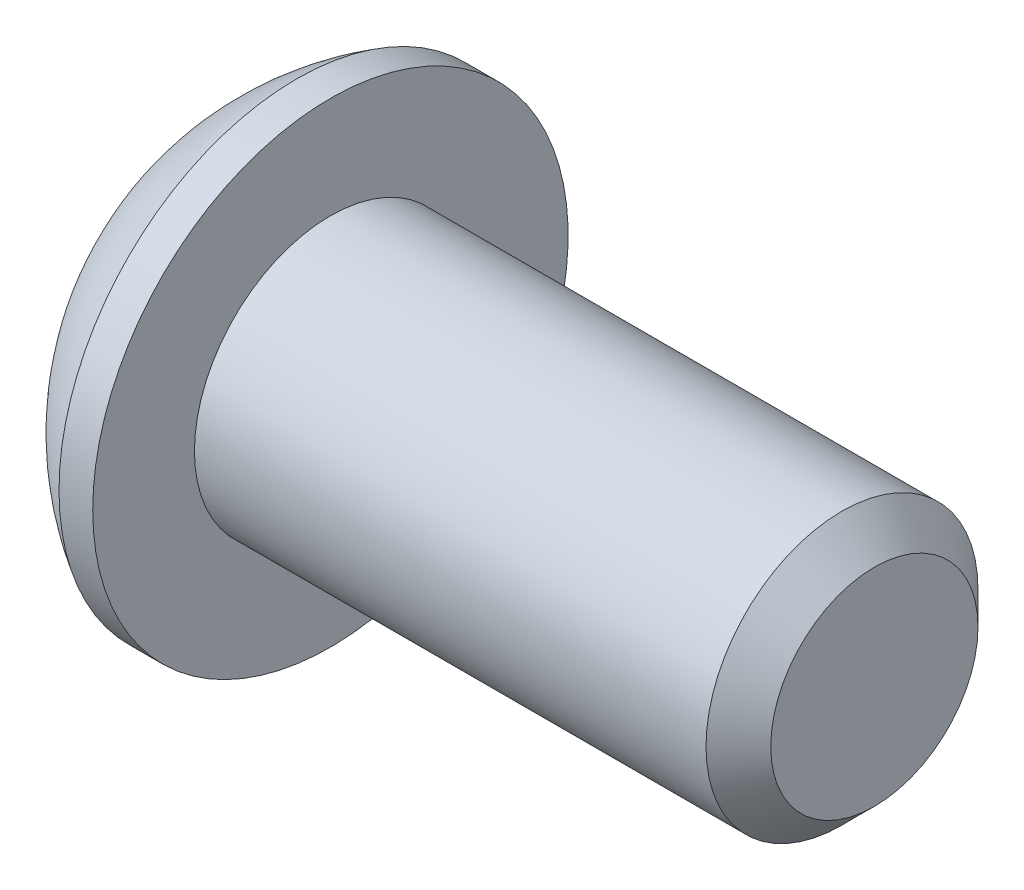
from build123d import *

# Parameters (mm, degrees)
HEX_2_DEPTH = 2.2098


with BuildPart() as part:
    # BodySke → BaseBody (revolve)
    with BuildSketch(Plane.XY, mode=Mode.PRIVATE) as basebody_sk:
        with BuildLine():
            Line((16.0528, 0), (16.0528, 2.41935))
            Line((16.0528, 2.41935), (15.29715, 3.175))
            Line((15.29715, 3.175), (3.3528, 3.175))
            Line((3.3528, 3.175), (3.3528, 5.5499))
            Line((3.3528, 5.5499), (2.5654, 5.5499))
            ThreePointArc((2.5654, 5.5499), (1.073764503, 4.355582759), (0, 2.77495))
            Line((0, 2.77495), (0, 0))
            Line((0, 0), (16.0528, 0))
        make_face()
    revolve(basebody_sk.sketch.rotate(Axis((0, 0, 0), (1, 0, 0)), 90), axis=Axis((0, 0, 0), (1, 0, 0)))

    # Sketch2 → PreBroach (revolve, cut)
    with BuildSketch(Plane.XY, mode=Mode.PRIVATE) as prebroach_sk:
        Polygon((0, 1.9812), (2.2098, 1.9812), (3.353646353, 0), (0, 0), align=None)
    revolve(prebroach_sk.sketch.rotate(Axis((0, 0, 0), (1, 0, 0)), 90), axis=Axis((0, 0, 0), (1, 0, 0)), mode=Mode.SUBTRACT)

    # Sketch3 → Hex 2 (cut)
    with BuildSketch(Plane(origin=(0, 0, 0), x_dir=(0, 0, -1), z_dir=(1, 0, 0))):
        Polygon((-1.9812, -1.143846353), (-1.9812, 1.143846353), (0, 2.287692707), (1.9812, 1.143846353), (1.9812, -1.143846353), (0, -2.287692707), align=None)
    extrude(amount=HEX_2_DEPTH, mode=Mode.SUBTRACT)


solid = part.part
